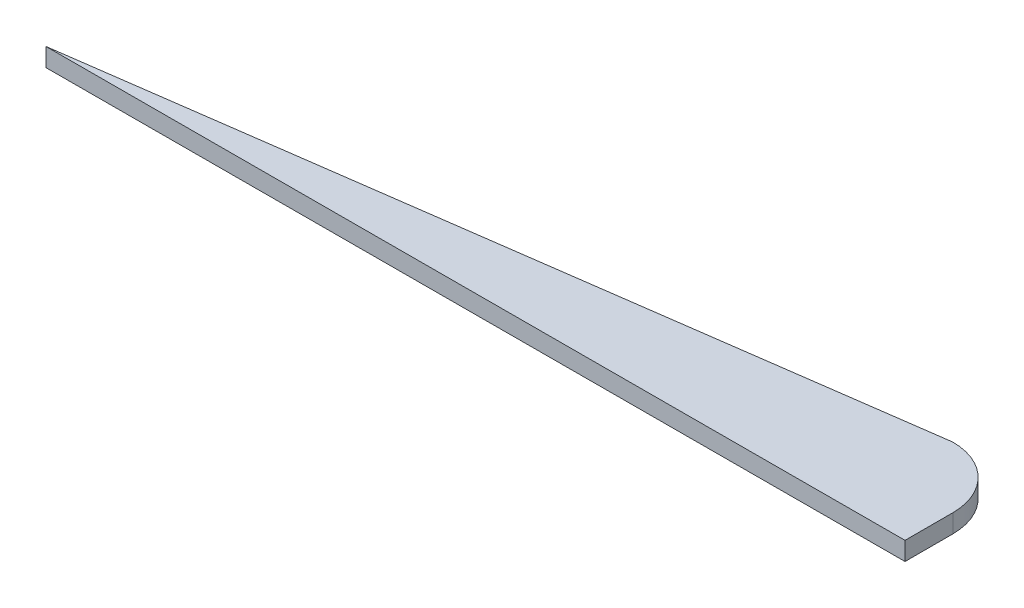
from build123d import *

# Parameters (mm, degrees)
BOSS_EXTRUDE2_DEPTH = 6


with BuildPart() as part:
    # Sketch1 → Boss-Extrude2 (new body)
    with BuildSketch(Plane(origin=(0, 0, 0), x_dir=(1, 0, 0), z_dir=(0, 1, 0))):
        with BuildLine():
            Line((39.037500682, 12.243272234), (39.037500682, 27.843272234))
            ThreePointArc((39.037500682, 27.843272234), (33.179636306, 41.985407858), (19.037500682, 47.843272234))
            Line((19.037500682, 47.843272234), (-240.962499318, 11.643272234))
            Line((-240.962499318, 11.643272234), (39.037500682, 12.243272234))
        make_face()
    extrude(amount=BOSS_EXTRUDE2_DEPTH)


solid = part.part
